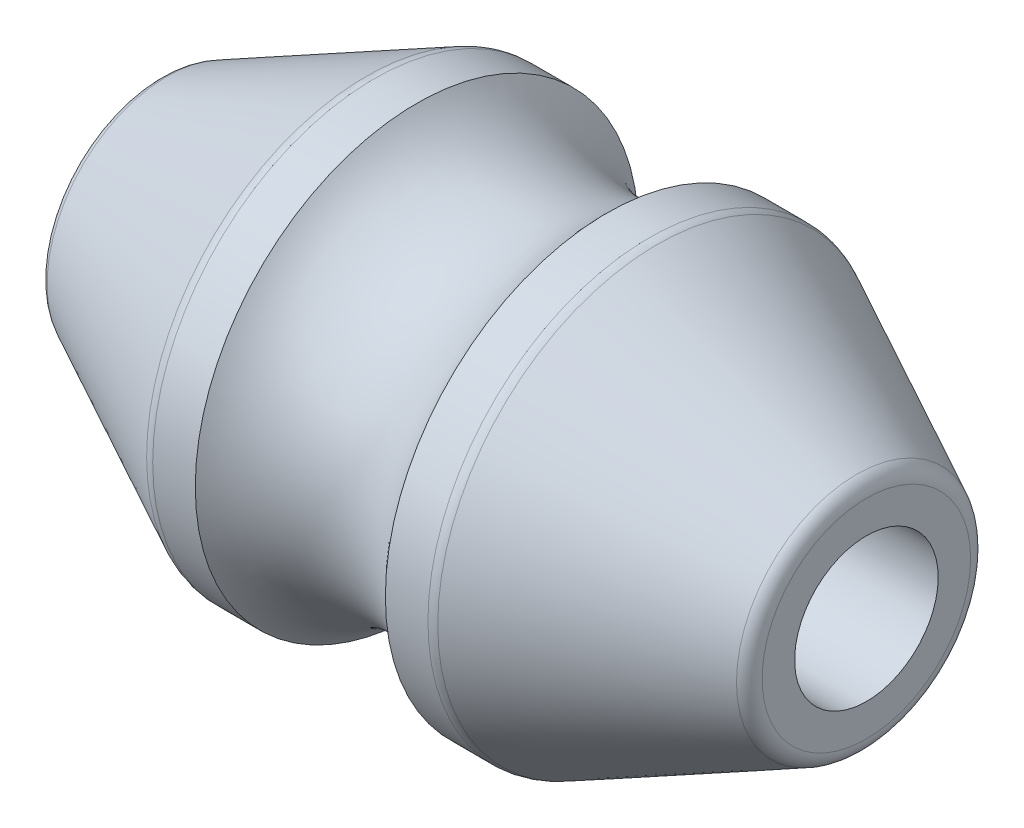
from build123d import *

# Parameters (mm, degrees)
CROQUIS1_R              = 12.5
CROQUIS1_R_2            = 4.05
SALIENTE_EXTRUIR1_DEPTH = 20
CROQUIS2_R              = 7
CHAFL_N1_SIZE           = 6
CHAFL_N1_SIZE2          = 12
CHAFL_N2_SIZE           = 12
CHAFL_N2_SIZE2          = 6
REDONDEO1_R             = 1


with BuildPart() as part:
    # Croquis1 → Saliente-Extruir1 (new, symmetric)
    with BuildSketch(Plane.YZ):
        with Locations(Location((0, 0, 0), (0, 0, 270))):
            Circle(CROQUIS1_R)
        with Locations(Location((0, 0, 0), (0, 0, 270))):
            Circle(CROQUIS1_R_2, mode=Mode.SUBTRACT)
    extrude(amount=SALIENTE_EXTRUIR1_DEPTH, both=True)

    # Croquis2 → Cortar-Revolución1 (revolve, cut)
    with BuildSketch(Plane(origin=(0, 0, 0), x_dir=(-1, 0, 0), z_dir=(0, 1, 0)), mode=Mode.PRIVATE) as cortar_revoluci_n1_sk:
        with Locations((0, 17)):
            Circle(CROQUIS2_R)
    revolve(cortar_revoluci_n1_sk.sketch.rotate(Axis((8.275317192, 0, 0), (-1, 0, 0)), 180), axis=Axis((8.275317192, 0, 0), (-1, 0, 0)), mode=Mode.SUBTRACT)

    # Chaflán1
    chafl_n1_edges = [part.edges().sort_by_distance(p)[0] for p in [
        (-20, 0, 12.5),
    ]]
    chafl_n1_side = [part.faces().sort_by_distance(p)[0] for p in [
        (-20, 0, 12.146446609),
    ]]
    chamfer(chafl_n1_edges, length=CHAFL_N1_SIZE, length2=CHAFL_N1_SIZE2, reference=chafl_n1_side[0])

    # Chaflán2
    chafl_n2_edges = [part.edges().sort_by_distance(p)[0] for p in [
        (20, 0, 12.5),
    ]]
    chafl_n2_side = [part.faces().sort_by_distance(p)[0] for p in [
        (12.680951324, 0, 12.5),
    ]]
    chamfer(chafl_n2_edges, length=CHAFL_N2_SIZE, length2=CHAFL_N2_SIZE2, reference=chafl_n2_side[0])

    # Redondeo1
    redondeo1_edges = [part.edges().sort_by_distance(p)[0] for p in [
        (-8, 0, 12.5),
        (-20, 0, 6.5),
        (20, 0, 6.5),
        (8, 0, 12.5),
    ]]
    fillet(redondeo1_edges, radius=REDONDEO1_R)


solid = part.part
